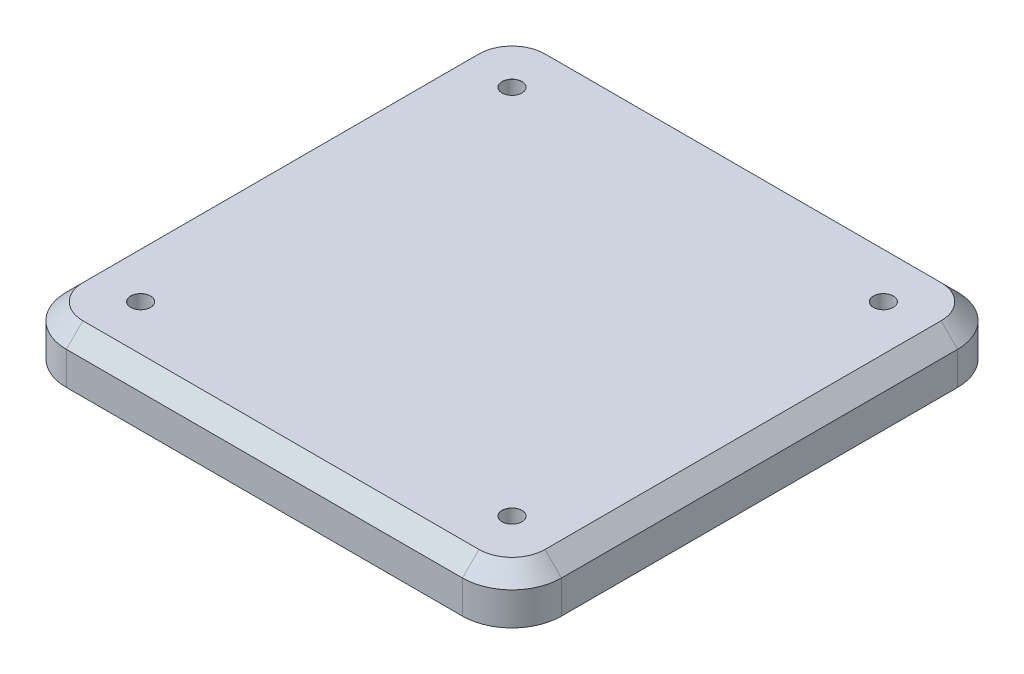
from build123d import *

# Parameters (mm, degrees)
SKETCH1_W                        = 300
SKETCH1_H                        = 300
BOSS_EXTRUDE1_DEPTH              = 30
F_12_0MM_DOWEL_HOLE2_D           = 12
F_12_0MM_DOWEL_HOLE2_DEPTH       = 10
F_12_0MM_DOWEL_HOLE2_CSINK_D     = 12.05
F_12_0MM_DOWEL_HOLE2_CSINK_ANGLE = 90
F_12_0MM_DOWEL_HOLE2_TIP         = 3.605163714
F_12_0MM_DOWEL_HOLE3_D           = 12
F_12_0MM_DOWEL_HOLE3_DEPTH       = 10
F_12_0MM_DOWEL_HOLE3_CSINK_D     = 12.05
F_12_0MM_DOWEL_HOLE3_CSINK_ANGLE = 90
F_12_0MM_DOWEL_HOLE3_TIP         = 3.605163714
FILLET1_R                        = 30
CHAMFER1_SIZE                    = 10


with BuildPart() as part:
    # Sketch1 → Boss-Extrude1 (new body)
    with BuildSketch(Plane(origin=(0, 0, 0), x_dir=(1, 0, 0), z_dir=(0, 1, 0))):
        Rectangle(SKETCH1_W, SKETCH1_H)
    extrude(amount=BOSS_EXTRUDE1_DEPTH)

    # Ø12.0mm Dowel Hole2
    with Locations(Plane(origin=(0, 30, 0), x_dir=(1, 0, 0), z_dir=(0, 1, 0))):
        with Locations((-112.5, 112.5), (112.5, 112.5), (112.5, -112.5), (-112.5, -112.5)):
            CounterSinkHole(F_12_0MM_DOWEL_HOLE2_D / 2, F_12_0MM_DOWEL_HOLE2_CSINK_D / 2, depth=F_12_0MM_DOWEL_HOLE2_DEPTH, counter_sink_angle=F_12_0MM_DOWEL_HOLE2_CSINK_ANGLE)
            with Locations((0, 0, -(F_12_0MM_DOWEL_HOLE2_DEPTH + F_12_0MM_DOWEL_HOLE2_TIP / 2))):  # 118° drill point
                Cone(0, F_12_0MM_DOWEL_HOLE2_D / 2, F_12_0MM_DOWEL_HOLE2_TIP, mode=Mode.SUBTRACT)

    # Ø12.0mm Dowel Hole3
    with Locations(Plane(origin=(0, 0, 0), x_dir=(-1, 0, 0), z_dir=(0, -1, 0))):
        with Locations((-125, 125), (125, 125), (125, -125), (-125, -125)):
            CounterSinkHole(F_12_0MM_DOWEL_HOLE3_D / 2, F_12_0MM_DOWEL_HOLE3_CSINK_D / 2, depth=F_12_0MM_DOWEL_HOLE3_DEPTH, counter_sink_angle=F_12_0MM_DOWEL_HOLE3_CSINK_ANGLE)
            with Locations((0, 0, -(F_12_0MM_DOWEL_HOLE3_DEPTH + F_12_0MM_DOWEL_HOLE3_TIP / 2))):  # 118° drill point
                Cone(0, F_12_0MM_DOWEL_HOLE3_D / 2, F_12_0MM_DOWEL_HOLE3_TIP, mode=Mode.SUBTRACT)

    # Fillet1
    fillet1_edges = [part.edges().sort_by_distance(p)[0] for p in [
        (150, 15, 150),
        (-150, 15, 150),
        (-150, 15, -150),
        (150, 15, -150),
    ]]
    fillet(fillet1_edges, radius=FILLET1_R)

    # Chamfer1
    chamfer1_edges = [part.edges().sort_by_distance(p)[0] for p in [
        (150, 30, 0),
        (0, 30, 150),
        (0, 30, -150),
        (-150, 30, 0),
        (-141.213203436, 30, 141.213203436),
        (141.213203436, 30, -141.213203436),
        (-141.213203436, 30, -141.213203436),
        (141.213203436, 30, 141.213203436),
    ]]
    chamfer(chamfer1_edges, length=CHAMFER1_SIZE)


solid = part.part
